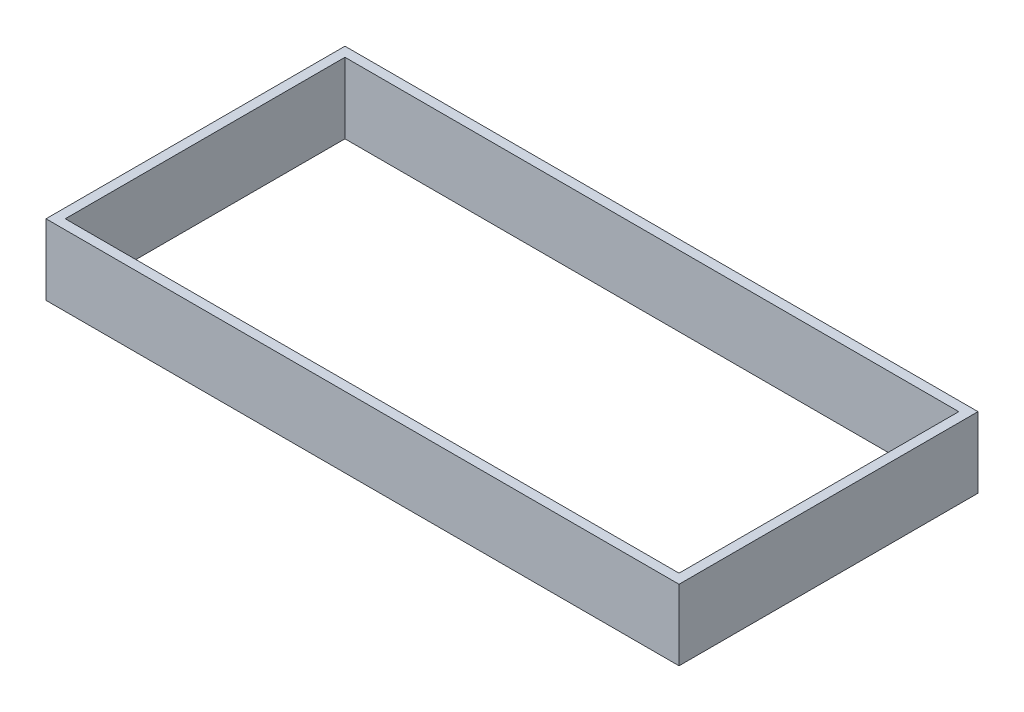
from build123d import *

# Parameters (mm, degrees)
SKETCH1_W           = 131.7
SKETCH1_H           = 62.2
SKETCH1_W_2         = 127.7
SKETCH1_H_2         = 58.2
BOSS_EXTRUDE1_DEPTH = 14.7


with BuildPart() as part:
    # Sketch1 → Boss-Extrude1 (new body)
    with BuildSketch(Plane(origin=(0, 0, 0), x_dir=(1, 0, 0), z_dir=(0, 1, 0))):
        Rectangle(SKETCH1_W, SKETCH1_H)
        Rectangle(SKETCH1_W_2, SKETCH1_H_2, mode=Mode.SUBTRACT)
    extrude(amount=BOSS_EXTRUDE1_DEPTH)


solid = part.part
